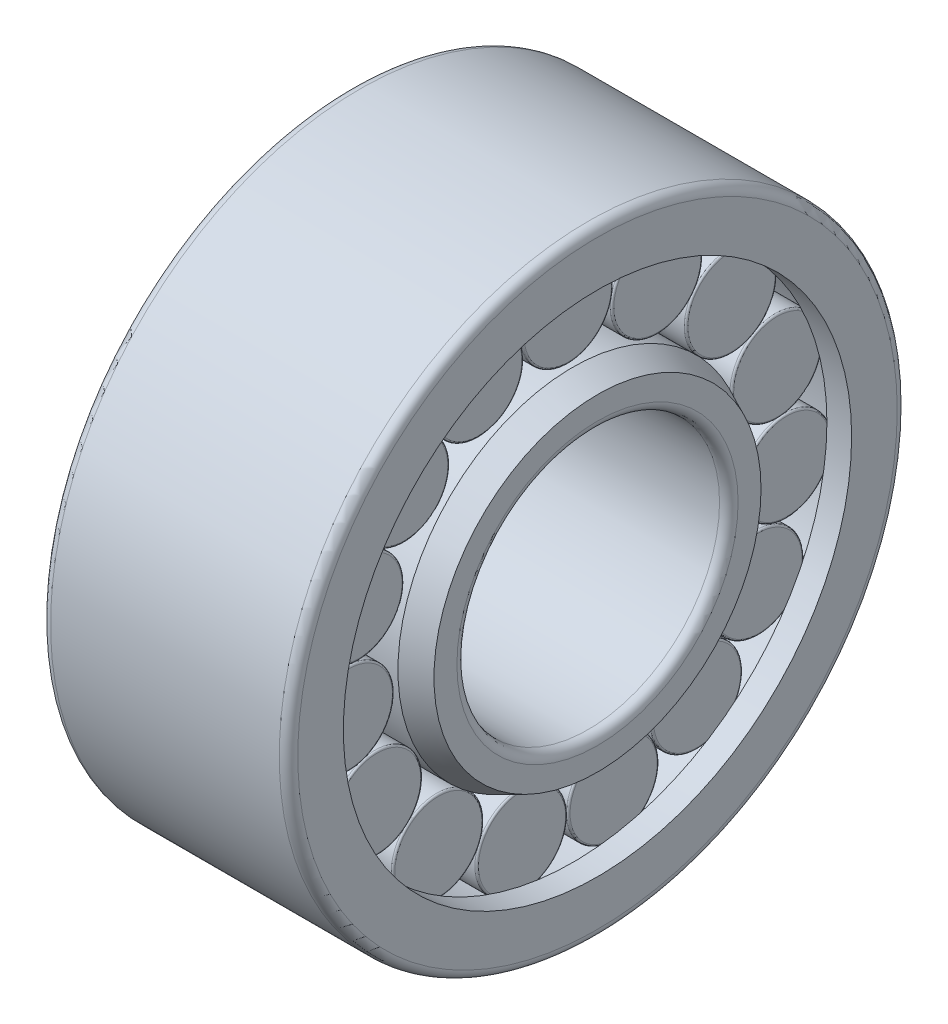
from build123d import *

# Parameters (mm, degrees)
ROLLERSDETAILED_COUNT = 15
ROLLERSDETAILED_ANGLE = 336


with BuildPart() as part:
    # OutRacSke → OuterRace (revolve)
    with BuildSketch(Plane.XY, mode=Mode.PRIVATE) as outerrace_sk:
        with BuildLine():
            Line((-6.4, 16.449375), (-8, 16.449375))
            Line((-8, 16.449375), (-8, 19.4))
            ThreePointArc((-8, 19.4), (-7.824264069, 19.824264069), (-7.4, 20))
            Line((-7.4, 20), (7.4, 20))
            ThreePointArc((7.4, 20), (7.824264069, 19.824264069), (8, 19.4))
            Line((8, 19.4), (8, 16.449375))
            Line((8, 16.449375), (6.4, 16.449375))
            Line((6.4, 16.449375), (6.4, 17.1825))
            Line((6.4, 17.1825), (-6.4, 17.1825))
            Line((-6.4, 17.1825), (-6.4, 16.449375))
        make_face()
    revolve(outerrace_sk.sketch.rotate(Axis((-90, 0, 0), (1, 0, 0)), 270), axis=Axis((-90, 0, 0), (1, 0, 0)))

    # RolDetSke → RollerDetailed (revolve)
    with BuildSketch(Plane.XY, mode=Mode.PRIVATE) as rollerdetailed_sk:
        with BuildLine():
            Line((-6.08, 17.07), (-6.08, 14.25))
            Line((-6.08, 14.25), (6.08, 14.25))
            Line((6.08, 14.25), (6.08, 17.07))
            ThreePointArc((6.08, 17.07), (6.045585047, 17.153085047), (5.9625, 17.1875))
            Line((5.9625, 17.1875), (-5.9625, 17.1875))
            ThreePointArc((-5.9625, 17.1875), (-6.045585047, 17.153085047), (-6.08, 17.07))
        make_face()
    rollerdetailed = revolve(rollerdetailed_sk.sketch.rotate(Axis((-33.6, 14.25, 0), (1, 0, 0)), 270), axis=Axis((-33.6, 14.25, 0), (1, 0, 0)))

    # InsRacSke → InnerRace (revolve)
    with BuildSketch(Plane.XY, mode=Mode.PRIVATE) as innerrace_sk:
        with BuildLine():
            Line((-6.4, 11.3175), (-8, 10.584375))
            Line((-8, 10.584375), (-8, 9.1))
            ThreePointArc((-8, 9.1), (-7.824264069, 8.675735931), (-7.4, 8.5))
            Line((-7.4, 8.5), (7.4, 8.5))
            ThreePointArc((7.4, 8.5), (7.824264069, 8.675735931), (8, 9.1))
            Line((8, 9.1), (8, 10.584375))
            Line((8, 10.584375), (6.4, 11.3175))
            Line((6.4, 11.3175), (-6.4, 11.3175))
        make_face()
    revolve(innerrace_sk.sketch.rotate(Axis((-90, 0, 0), (1, 0, 0)), 270), axis=Axis((-90, 0, 0), (1, 0, 0)))

    # RollersDetailed: RollerDetailed ×15 about axis
    rollersdetailed_axis = Axis((-50, 0, 0), (1, 0, 0))
    for i in range(1, ROLLERSDETAILED_COUNT):
        add(rollerdetailed.rotate(rollersdetailed_axis, i * ROLLERSDETAILED_ANGLE / (ROLLERSDETAILED_COUNT - 1)))


solid = part.part
